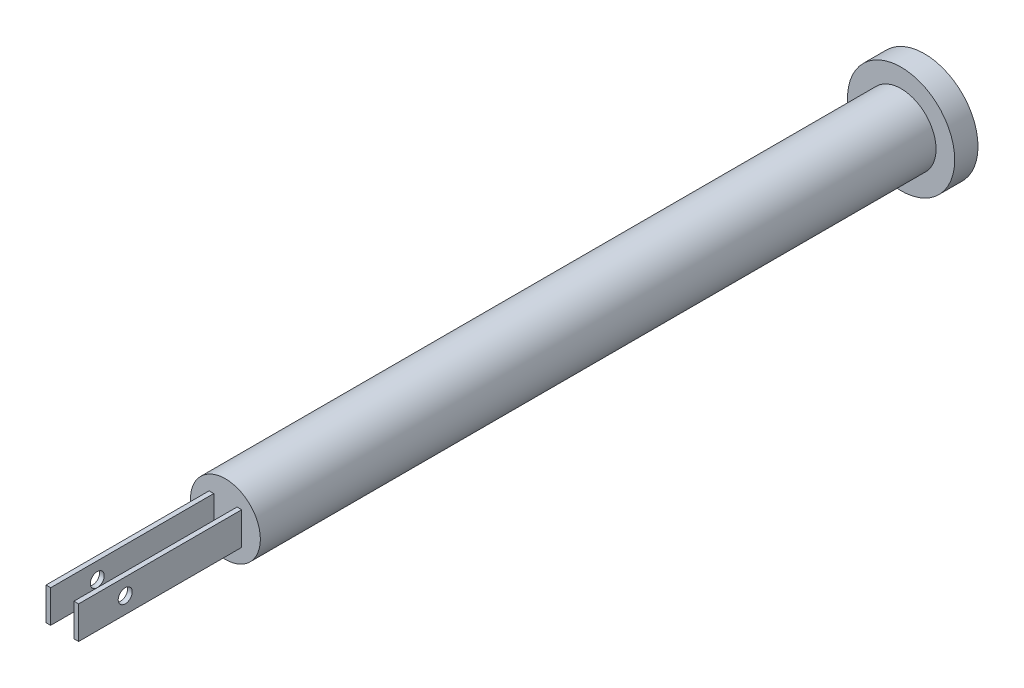
from build123d import *

# Parameters (mm, degrees)
SKETCH1_R           = 7.5
BOSS_EXTRUDE2_DEPTH = 150
SKETCH1_4_R         = 11.5
SKETCH1_4_R_2       = 7.5
BOSS_EXTRUDE3_DEPTH = 5
SKETCH3_W           = 7
SKETCH3_H           = 7
BOSS_EXTRUDE4_DEPTH = 35
SKETCH7_W           = 5
SKETCH7_H           = 35
CUT_EXTRUDE2_DEPTH  = 10
SKETCH8_R           = 1.5
CUT_EXTRUDE3_DEPTH  = 10


with BuildPart() as part:
    # Sketch1 → Boss-Extrude2 (new body)
    with BuildSketch(Plane.XY):
        Circle(SKETCH1_R)
    extrude(amount=BOSS_EXTRUDE2_DEPTH)

    # Sketch1<4> → Boss-Extrude3 (add)
    with BuildSketch(Plane.XY):
        Circle(SKETCH1_4_R)
        Circle(SKETCH1_4_R_2, mode=Mode.SUBTRACT)
    extrude(amount=BOSS_EXTRUDE3_DEPTH)

    # Sketch3 → Boss-Extrude4 (add)
    with BuildSketch(Plane.XY.offset(150)):
        Rectangle(SKETCH3_W, SKETCH3_H)
    extrude(amount=BOSS_EXTRUDE4_DEPTH)

    # Sketch7 → Cut-Extrude2 (cut)
    with BuildSketch(Plane(origin=(0, 3.5, 0), x_dir=(1, 0, 0), z_dir=(0, 1, 0))):
        with Locations((0, -167.5)):
            Rectangle(SKETCH7_W, SKETCH7_H)
    extrude(amount=-CUT_EXTRUDE2_DEPTH, mode=Mode.SUBTRACT)

    # Sketch8 → Cut-Extrude3 (cut)
    with BuildSketch(Plane(origin=(3.5, 0, 0), x_dir=(0, 0, -1), z_dir=(1, 0, 0))):
        with Locations((-175, 0)):
            Circle(SKETCH8_R)
    extrude(amount=-CUT_EXTRUDE3_DEPTH, mode=Mode.SUBTRACT)


solid = part.part
